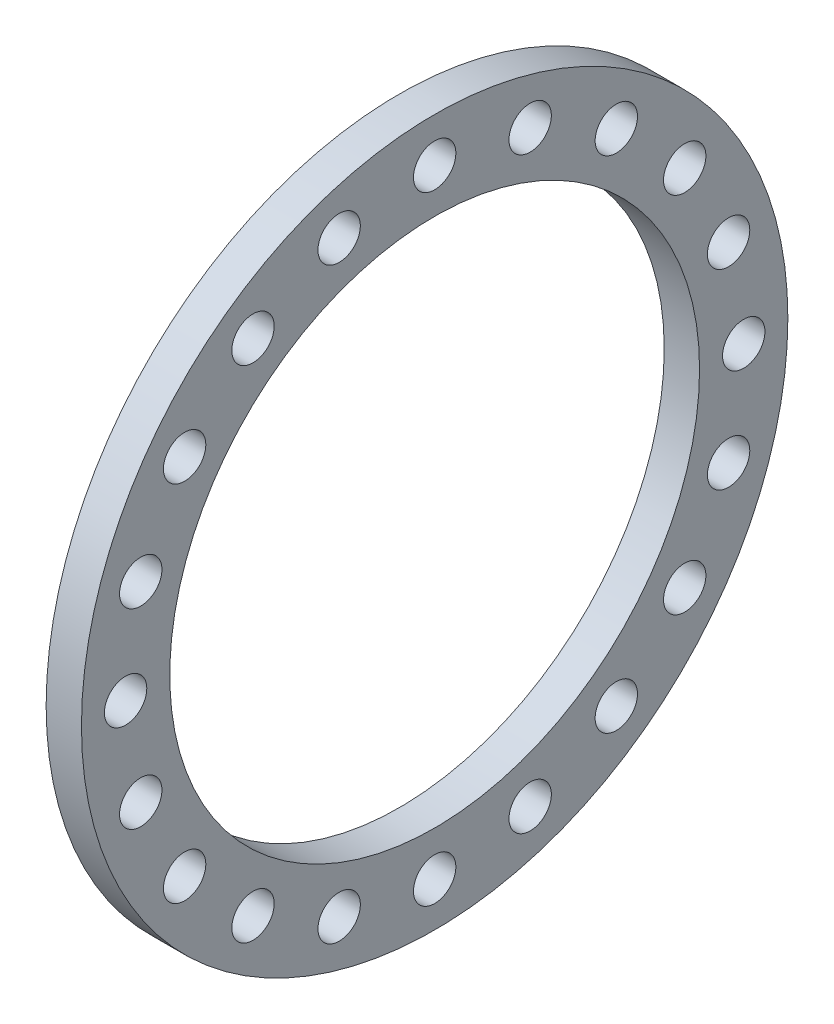
from build123d import *

# Parameters (mm, degrees)
SKETCH_1_R      = 50
SKETCH_1_R_2    = 37.5
SKETCH_1_R_3    = 3
EXTRUDE_1_DEPTH = 5


with BuildPart() as part:
    # Эскиз1 → Бобышка-Вытянуть1 (new body)
    with BuildSketch(Plane(origin=(0, 0, 0), x_dir=(0, 0, -1), z_dir=(1, 0, 0))):
        Circle(SKETCH_1_R)
        Circle(SKETCH_1_R_2, mode=Mode.SUBTRACT)
        with Locations((0, 43.75)):
            Circle(SKETCH_1_R_3, mode=Mode.SUBTRACT)
        with Locations((13.519493504, 41.608722588)):
            Circle(SKETCH_1_R_3, mode=Mode.SUBTRACT)
        with Locations((25.715604788, 35.394493504)):
            Circle(SKETCH_1_R_3, mode=Mode.SUBTRACT)
        with Locations((35.394493504, 25.715604788)):
            Circle(SKETCH_1_R_3, mode=Mode.SUBTRACT)
        with Locations((41.608722588, 13.519493504)):
            Circle(SKETCH_1_R_3, mode=Mode.SUBTRACT)
        with Locations((43.75, 0)):
            Circle(SKETCH_1_R_3, mode=Mode.SUBTRACT)
        with Locations((41.608722588, -13.519493504)):
            Circle(SKETCH_1_R_3, mode=Mode.SUBTRACT)
        with Locations((35.394493504, -25.715604788)):
            Circle(SKETCH_1_R_3, mode=Mode.SUBTRACT)
        with Locations((25.715604788, -35.394493504)):
            Circle(SKETCH_1_R_3, mode=Mode.SUBTRACT)
        with Locations((13.519493504, -41.608722588)):
            Circle(SKETCH_1_R_3, mode=Mode.SUBTRACT)
        with Locations((0, -43.75)):
            Circle(SKETCH_1_R_3, mode=Mode.SUBTRACT)
        with Locations((-13.519493504, -41.608722588)):
            Circle(SKETCH_1_R_3, mode=Mode.SUBTRACT)
        with Locations((-25.715604788, -35.394493504)):
            Circle(SKETCH_1_R_3, mode=Mode.SUBTRACT)
        with Locations((-35.394493504, -25.715604788)):
            Circle(SKETCH_1_R_3, mode=Mode.SUBTRACT)
        with Locations((-41.608722588, -13.519493504)):
            Circle(SKETCH_1_R_3, mode=Mode.SUBTRACT)
        with Locations((-43.75, 0)):
            Circle(SKETCH_1_R_3, mode=Mode.SUBTRACT)
        with Locations((-41.608722588, 13.519493504)):
            Circle(SKETCH_1_R_3, mode=Mode.SUBTRACT)
        with Locations((-35.394493504, 25.715604788)):
            Circle(SKETCH_1_R_3, mode=Mode.SUBTRACT)
        with Locations((-25.715604788, 35.394493504)):
            Circle(SKETCH_1_R_3, mode=Mode.SUBTRACT)
        with Locations((-13.519493504, 41.608722588)):
            Circle(SKETCH_1_R_3, mode=Mode.SUBTRACT)
    extrude(amount=EXTRUDE_1_DEPTH)


solid = part.part
